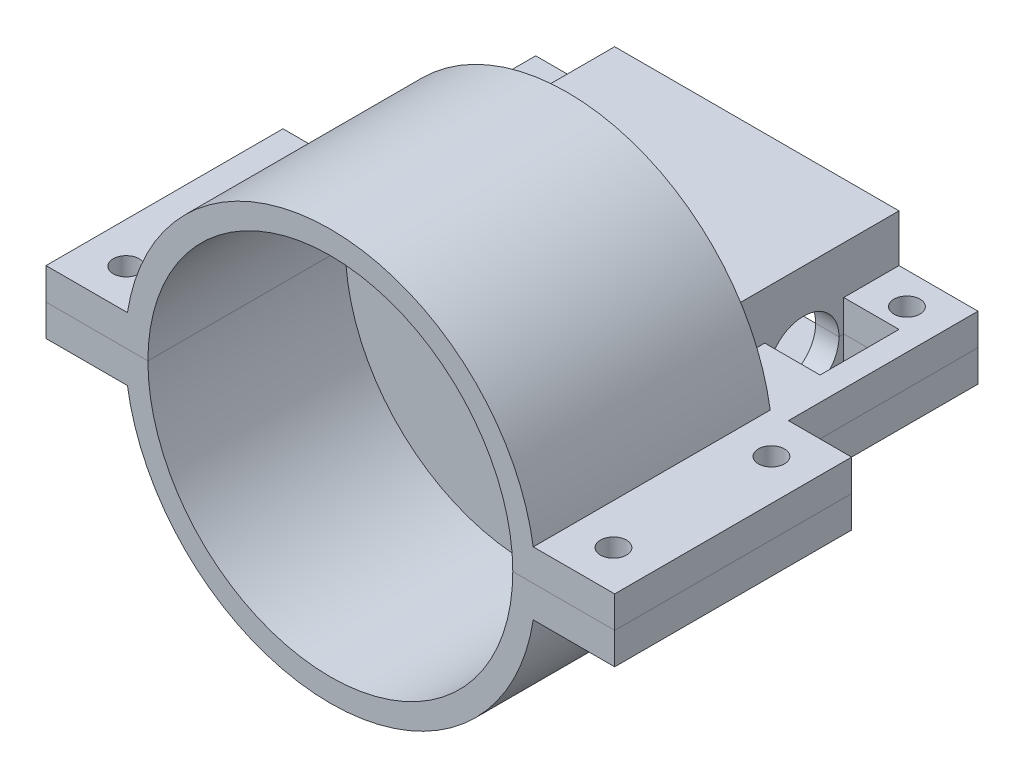
from build123d import *

# Parameters (mm, degrees)
SKETCH_1_R           = 26
SKETCH_1_R_2         = 23.1
EXTRUDE_1_DEPTH      = 25
EXTRUDE_START        = 5
SKETCH_2_R           = 26
EXTRUDE_2_DEPTH      = 5
SKETCH_3_W           = 36
SKETCH_3_H           = 20
SKETCH_3_W_2         = 30.1
SKETCH_3_H_2         = 15.2
EXTRUDE_3_DEPTH      = 24
CUT_EXTRUDE_1_REACH  = 60.762
SKETCH_4_R           = 4.5
EXTRUDE_4_DEPTH      = 4
EXTRUDE_4_DEPTH_BACK = 4
SKETCH_5_W           = 10
SKETCH_5_H           = 24
SKETCH_5_W_2         = 11
SKETCH_5_H_2         = 30
CUT_EXTRUDE_2_REACH  = 57.109
SKETCH_6_R           = 1.65
SKETCH_6_W           = 7
SKETCH_6_H           = 10


with BuildPart() as part:
    # ｽｹｯﾁ1 → ﾎﾞｽ - 押し出し1 (new body)
    with BuildSketch(Plane.XY):
        Circle(SKETCH_1_R)
        Circle(SKETCH_1_R_2, mode=Mode.SUBTRACT)
    extrude(amount=EXTRUDE_1_DEPTH)

    # ｽｹｯﾁ2 → ﾎﾞｽ - 押し出し2 (add)
    with BuildSketch(Plane(origin=(0, 0, 0), x_dir=(-1, 0, 0), z_dir=(0, 0, -1)).offset(EXTRUDE_START)):
        Circle(SKETCH_2_R)
    extrude(amount=-EXTRUDE_2_DEPTH)

    # ｽｹｯﾁ3 → ﾎﾞｽ - 押し出し3 (add)
    with BuildSketch(Plane(origin=(0, 0, -5), x_dir=(-1, 0, 0), z_dir=(0, 0, -1))):
        Rectangle(SKETCH_3_W, SKETCH_3_H)
        Rectangle(SKETCH_3_W_2, SKETCH_3_H_2, mode=Mode.SUBTRACT)
    extrude(amount=EXTRUDE_3_DEPTH)

    # ｶｯﾄ - 押し出し1: up to this face of the body (flat: up to its plane)
    cut_extrude_1_end = Plane(part.part.faces().sort_by_distance((-18, 0, -17))[0])
    # ｽｹｯﾁ4 → ｶｯﾄ - 押し出し1 (cut, up to the picked face)
    with BuildSketch(Plane(origin=(18, 0, 0), x_dir=(0, 0, -1), z_dir=(1, 0, 0)), mode=Mode.PRIVATE) as cut_extrude_1_sk1:
        with Locations((16.9, 0)):
            Circle(SKETCH_4_R)
    cut_extrude_1_tool1 = split(extrude(cut_extrude_1_sk1.sketch, amount=-CUT_EXTRUDE_1_REACH, mode=Mode.PRIVATE), bisect_by=cut_extrude_1_end, keep=Keep.BOTH, mode=Mode.PRIVATE)
    add(cut_extrude_1_tool1.solids().sort_by(Axis((18, 0, -16.9), (-1, 0, 0)))[0], mode=Mode.SUBTRACT)

    # ｽｹｯﾁ5 → ﾎﾞｽ - 押し出し4 (add, two sides: drawn at the far end of the back side and taken through both)
    with BuildSketch(Plane(origin=(0, 0, 0), x_dir=(1, 0, 0), z_dir=(0, 1, 0)).offset(-EXTRUDE_4_DEPTH_BACK)):
        Polygon((28, 5), (25, 5), (25, -25), (36, -25), (36, 5), align=None)
        with Locations((23, 17)):
            Rectangle(SKETCH_5_W, SKETCH_5_H)
        Polygon((-28, 29), (-28, 5), (-25, 5), (-18, 5), (-18, 29), align=None)
        with Locations((-30.5, -10)):
            Rectangle(SKETCH_5_W_2, SKETCH_5_H_2)
    extrude(amount=EXTRUDE_4_DEPTH + EXTRUDE_4_DEPTH_BACK)

    # ｽｹｯﾁ6 → ｶｯﾄ - 押し出し2 (cut, up to next)
    with BuildSketch(Plane(origin=(0, 4, 0), x_dir=(1, 0, 0), z_dir=(0, 1, 0)), mode=Mode.PRIVATE) as cut_extrude_2_sk1:
        with Locations(Location((23, 25, 0), (0, 0, 270))):
            Circle(SKETCH_6_R)
    cut_extrude_2_tool1 = extrude(cut_extrude_2_sk1.sketch, amount=-CUT_EXTRUDE_2_REACH, mode=Mode.PRIVATE) & part.part
    # ｽｹｯﾁ6 → ｶｯﾄ - 押し出し2 (cut, up to next)
    with BuildSketch(Plane(origin=(0, 4, 0), x_dir=(1, 0, 0), z_dir=(0, 1, 0)), mode=Mode.PRIVATE) as cut_extrude_2_sk2:
        with Locations(Location((30.845232579, 0, 0), (0, 0, 270))):
            Circle(SKETCH_6_R)
    cut_extrude_2_tool2 = extrude(cut_extrude_2_sk2.sketch, amount=-CUT_EXTRUDE_2_REACH, mode=Mode.PRIVATE) & part.part
    # ｽｹｯﾁ6 → ｶｯﾄ - 押し出し2 (cut, up to next)
    with BuildSketch(Plane(origin=(0, 4, 0), x_dir=(1, 0, 0), z_dir=(0, 1, 0)), mode=Mode.PRIVATE) as cut_extrude_2_sk3:
        with Locations(Location((30.845232579, -20, 0), (0, 0, 270))):
            Circle(SKETCH_6_R)
    cut_extrude_2_tool3 = extrude(cut_extrude_2_sk3.sketch, amount=-CUT_EXTRUDE_2_REACH, mode=Mode.PRIVATE) & part.part
    # ｽｹｯﾁ6 → ｶｯﾄ - 押し出し2 (cut, up to next)
    with BuildSketch(Plane(origin=(0, 4, 0), x_dir=(1, 0, 0), z_dir=(0, 1, 0)), mode=Mode.PRIVATE) as cut_extrude_2_sk4:
        with Locations(Location((-30.845232579, -20, 0), (0, 0, 270))):
            Circle(SKETCH_6_R)
    cut_extrude_2_tool4 = extrude(cut_extrude_2_sk4.sketch, amount=-CUT_EXTRUDE_2_REACH, mode=Mode.PRIVATE) & part.part
    # ｽｹｯﾁ6 → ｶｯﾄ - 押し出し2 (cut, up to next)
    with BuildSketch(Plane(origin=(0, 4, 0), x_dir=(1, 0, 0), z_dir=(0, 1, 0)), mode=Mode.PRIVATE) as cut_extrude_2_sk5:
        with Locations(Location((-30.845232579, 0, 0), (0, 0, 270))):
            Circle(SKETCH_6_R)
    cut_extrude_2_tool5 = extrude(cut_extrude_2_sk5.sketch, amount=-CUT_EXTRUDE_2_REACH, mode=Mode.PRIVATE) & part.part
    # ｽｹｯﾁ6 → ｶｯﾄ - 押し出し2 (cut, up to next)
    with BuildSketch(Plane(origin=(0, 4, 0), x_dir=(1, 0, 0), z_dir=(0, 1, 0)), mode=Mode.PRIVATE) as cut_extrude_2_sk6:
        with Locations(Location((-23, 25, 0), (0, 0, 270))):
            Circle(SKETCH_6_R)
    cut_extrude_2_tool6 = extrude(cut_extrude_2_sk6.sketch, amount=-CUT_EXTRUDE_2_REACH, mode=Mode.PRIVATE) & part.part
    # ｽｹｯﾁ6 → ｶｯﾄ - 押し出し2 (cut, up to next)
    with BuildSketch(Plane(origin=(0, 4, 0), x_dir=(1, 0, 0), z_dir=(0, 1, 0)), mode=Mode.PRIVATE) as cut_extrude_2_sk7:
        with Locations((21.5, 17)):
            Rectangle(SKETCH_6_W, SKETCH_6_H)
    cut_extrude_2_tool7 = extrude(cut_extrude_2_sk7.sketch, amount=-CUT_EXTRUDE_2_REACH, mode=Mode.PRIVATE) & part.part
    # ｽｹｯﾁ6 → ｶｯﾄ - 押し出し2 (cut, up to next)
    with BuildSketch(Plane(origin=(0, 4, 0), x_dir=(1, 0, 0), z_dir=(0, 1, 0)), mode=Mode.PRIVATE) as cut_extrude_2_sk8:
        with Locations((-21.5, 17)):
            Rectangle(SKETCH_6_W, SKETCH_6_H)
    cut_extrude_2_tool8 = extrude(cut_extrude_2_sk8.sketch, amount=-CUT_EXTRUDE_2_REACH, mode=Mode.PRIVATE) & part.part
    add(cut_extrude_2_tool1.solids().sort_by_distance((23, 4, -25))[0], mode=Mode.SUBTRACT)
    add(cut_extrude_2_tool2.solids().sort_by_distance((30.845233, 4, 0))[0], mode=Mode.SUBTRACT)
    add(cut_extrude_2_tool3.solids().sort_by_distance((30.845233, 4, 20))[0], mode=Mode.SUBTRACT)
    add(cut_extrude_2_tool4.solids().sort_by_distance((-30.845233, 4, 20))[0], mode=Mode.SUBTRACT)
    add(cut_extrude_2_tool5.solids().sort_by_distance((-30.845233, 4, 0))[0], mode=Mode.SUBTRACT)
    add(cut_extrude_2_tool6.solids().sort_by_distance((-23, 4, -25))[0], mode=Mode.SUBTRACT)
    add(cut_extrude_2_tool7.solids().sort_by_distance((21.5, 4, -17))[0], mode=Mode.SUBTRACT)
    add(cut_extrude_2_tool8.solids().sort_by_distance((-21.5, 4, -17))[0], mode=Mode.SUBTRACT)


with BuildPart() as body_2:
    # Split Bodies 1: the piece on the far side of the plane
    add(part.part)
    split(bisect_by=Plane.ZX, keep=Keep.BOTTOM)


with BuildPart() as part_1:
    add(part.part)

    # Split Bodies 1
    split(bisect_by=Plane.ZX, keep=Keep.TOP)


solid = Compound([body_2.part, part_1.part])
